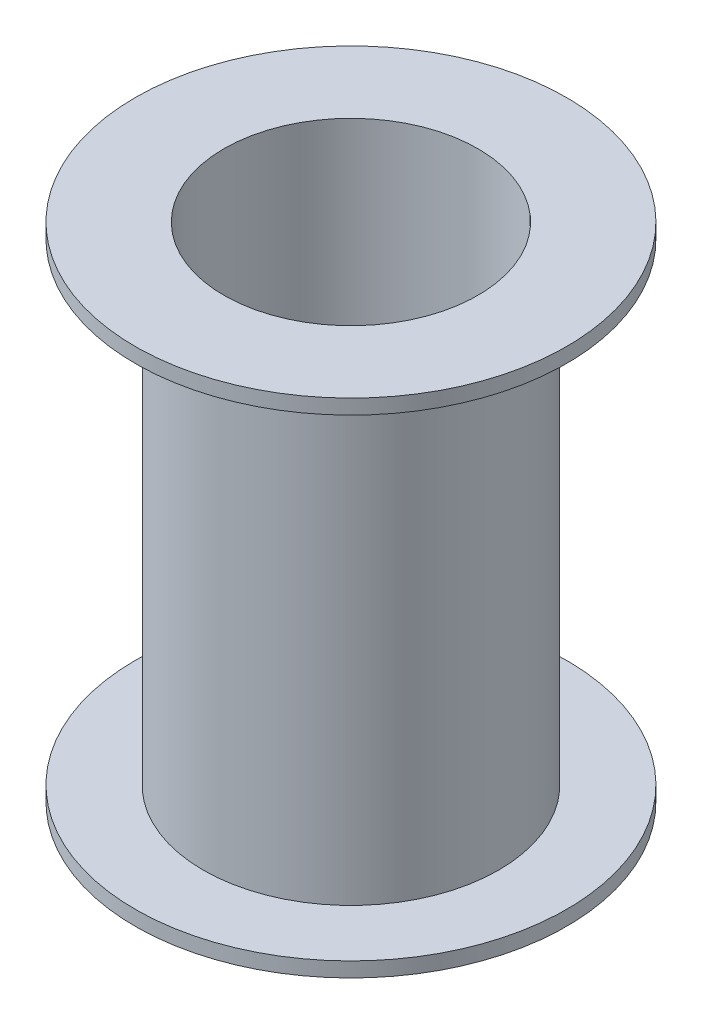
from build123d import *


with BuildPart() as part:
    # Sketch1 → Revolve1 (revolve)
    with BuildSketch(Plane.XY, mode=Mode.PRIVATE) as revolve1_sk:
        Polygon((0.43, 0), (0.73, 0), (0.73, 0.05), (0.5, 0.05), (0.5, 1.65), (0.73, 1.65), (0.73, 1.7), (0.43, 1.7), align=None)
    revolve(revolve1_sk.sketch.rotate(Axis((0, 1.7, 0), (0, -1, 0)), 180), axis=Axis((0, 1.7, 0), (0, -1, 0)))


solid = part.part
